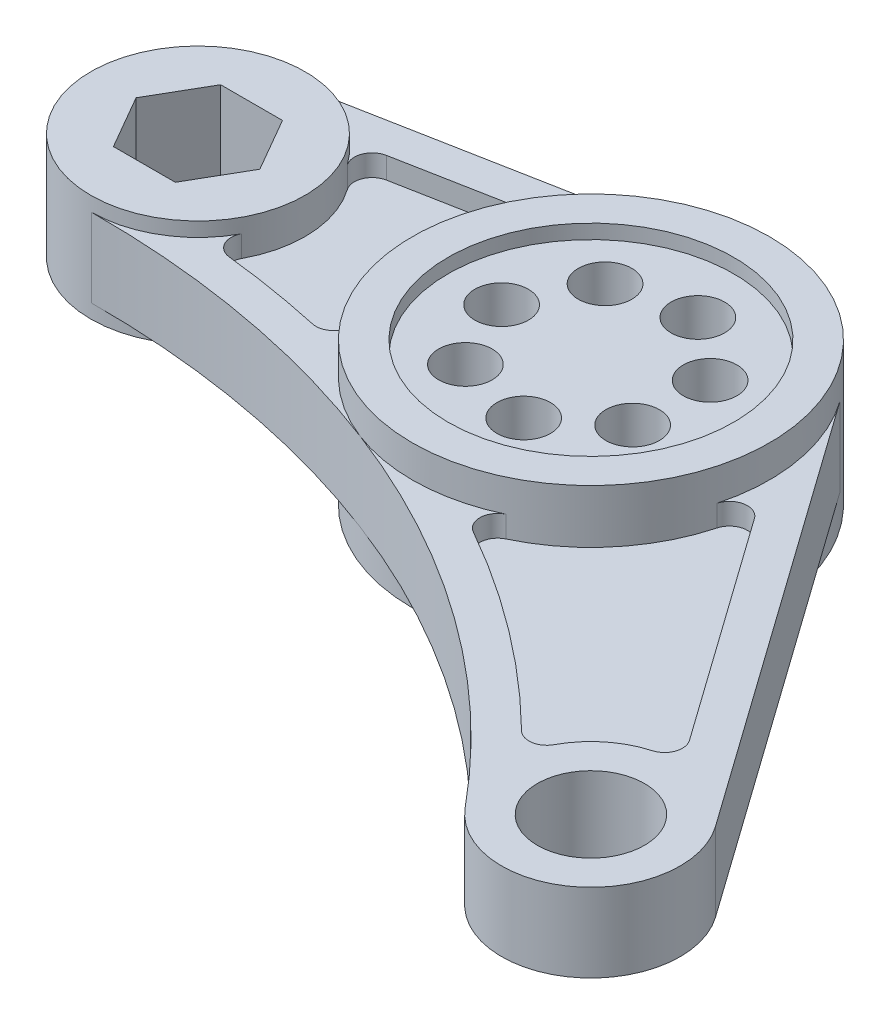
from build123d import *

# Parameters (mm, degrees)
SKETCH_1_R          = 50
SKETCH_1_R_2        = 7.5
EXTRUDE_2_DEPTH     = 20
SKETCH_4_R          = 40
CUT_EXTRUDE_1_DEPTH = 4
SKETCH_6_R          = 30
EXTRUDE_5_DEPTH     = 15
SKETCH_8_R          = 25
SKETCH_8_R_2        = 15
EXTRUDE_6_DEPTH     = 11
EXTRUDE_7_DEPTH     = 11
CUT_EXTRUDE_START   = 11
CUT_EXTRUDE_2_DEPTH = 6
CUT_EXTRUDE_START_2 = -6
CUT_EXTRUDE_3_DEPTH = 6


with BuildPart() as part:
    # 草图1 → 凸台-拉伸2 (new, symmetric)
    with BuildSketch(Plane(origin=(0, 0, 0), x_dir=(1, 0, 0), z_dir=(0, 1, 0))):
        with Locations(Location((0, 0, 0), (0, 0, 270))):
            Circle(SKETCH_1_R)
        with Locations(Location((-25, 0, 0), (0, 0, 270))):
            Circle(SKETCH_1_R_2, mode=Mode.SUBTRACT)
        with Locations(Location((-15.587245046, 19.545787062, 0), (0, 0, 270))):
            Circle(SKETCH_1_R_2, mode=Mode.SUBTRACT)
        with Locations(Location((5.563023349, 24.373197805, 0), (0, 0, 270))):
            Circle(SKETCH_1_R_2, mode=Mode.SUBTRACT)
        with Locations(Location((22.524221698, 10.847093478, 0), (0, 0, 270))):
            Circle(SKETCH_1_R_2, mode=Mode.SUBTRACT)
        with Locations(Location((22.524221698, -10.847093478, 0), (0, 0, 270))):
            Circle(SKETCH_1_R_2, mode=Mode.SUBTRACT)
        with Locations(Location((5.563023349, -24.373197805, 0), (0, 0, 270))):
            Circle(SKETCH_1_R_2, mode=Mode.SUBTRACT)
        with Locations(Location((-15.587245046, -19.545787062, 0), (0, 0, 270))):
            Circle(SKETCH_1_R_2, mode=Mode.SUBTRACT)
    extrude(amount=EXTRUDE_2_DEPTH, both=True)

    # 草图4 → 切除-拉伸1 (cut)
    with BuildSketch(Plane(origin=(0, 20, 0), x_dir=(1, 0, 0), z_dir=(0, 1, 0))):
        with Locations(Location((0, 0, 0), (0, 0, 270))):
            Circle(SKETCH_4_R)
    cut_extrude_1 = extrude(amount=-CUT_EXTRUDE_1_DEPTH, mode=Mode.SUBTRACT)

    # 镜向1: 切除-拉伸1 across plane
    add(cut_extrude_1.mirror(Plane.ZX), mode=Mode.SUBTRACT)



with BuildPart() as body_2:
    # 草图6 → 凸台-拉伸5 (new, symmetric)
    with BuildSketch(Plane(origin=(0, 0, 0), x_dir=(1, 0, 0), z_dir=(0, 1, 0))):
        with Locations(Location((-110, 0, 0), (0, 0, 270))):
            Circle(SKETCH_6_R)
        Polygon((-92.679491924, 0), (-101.339745962, 15), (-118.660254038, 15), (-127.320508076, 0), (-118.660254038, -15), (-101.339745962, -15), align=None, mode=Mode.SUBTRACT)
    extrude(amount=EXTRUDE_5_DEPTH, both=True)


with BuildPart() as body_3:
    # 草图8 → 凸台-拉伸6 (new, symmetric)
    with BuildSketch(Plane(origin=(0, 0, 0), x_dir=(1, 0, 0), z_dir=(0, 1, 0))):
        with Locations(Location((106.066017178, -106.066017178, 0), (0, 0, 270))):
            Circle(SKETCH_8_R)
        with Locations(Location((106.066017178, -106.066017178, 0), (0, 0, 270))):
            Circle(SKETCH_8_R_2, mode=Mode.SUBTRACT)
    extrude(amount=EXTRUDE_6_DEPTH, both=True)


with BuildPart() as part_1:
    add(part.part)

    add(body_2.part)  # 凸台-拉伸7 merges body 2

    add(body_3.part)  # 凸台-拉伸7 merges body 3
    # 草图9 → 凸台-拉伸7 (add, symmetric)
    with BuildSketch(Plane(origin=(0, 0, 0), x_dir=(1, 0, 0), z_dir=(0, 1, 0))):
        with BuildLine():
            Line((-9.330441424, 49.121714779), (-110, 30))
            ThreePointArc((-110, 30), (-88.786796564, 21.213203436), (-80, 0))
            ThreePointArc((-80, 0), (-88.71993646, -21.146131933), (-109.810593048, -29.999402077))
            ThreePointArc((-109.810593048, -29.999402077), (-63.064827616, -34.060904943), (-17.875950367, -46.695293108))
            ThreePointArc((-17.875950367, -46.695293108), (-49.802326137, 4.44165637), (-9.330441424, 49.121714779))
        make_face()
        with BuildLine():
            Line((126.442712652, -91.581878213), (40.753390949, 28.968277929))
            ThreePointArc((40.753390949, 28.968277929), (47.632287093, 15.204118727), (50, 0))
            ThreePointArc((50, 0), (28.33904093, -41.19343102), (-17.875950367, -46.695293108))
            ThreePointArc((-17.875950367, -46.695293108), (39.329861169, -77.545156319), (86.774183491, -121.966493681))
            ThreePointArc((86.774183491, -121.966493681), (90.864028968, -86.219114285), (126.442712652, -91.581878213))
        make_face()
    extrude(amount=EXTRUDE_7_DEPTH, both=True)

    # 草图10 → 切除-拉伸2 (cut)
    with BuildSketch(Plane(origin=(0, 0, 0), x_dir=(1, 0, 0), z_dir=(0, 1, 0)).offset(CUT_EXTRUDE_START)):
        with BuildLine():
            ThreePointArc((-43.829514678, 24.061871148), (-49.930321788, 2.638743289), (-46.121552708, -19.308090941))
            ThreePointArc((-46.121552708, -19.308090941), (-46.894642878, -24.442270002), (-51.807391271, -26.122259963))
            ThreePointArc((-51.807391271, -26.122259963), (-65.699920333, -23.457746699), (-79.715740029, -21.544949554))
            ThreePointArc((-79.715740029, -21.544949554), (-83.598085675, -18.902773341), (-83.577090418, -14.206683259))
            ThreePointArc((-83.577090418, -14.206683259), (-80.054612182, 1.80935028), (-85.479855197, 17.284747578))
            ThreePointArc((-85.479855197, 17.284747578), (-86.028032441, 22.041171589), (-82.326208539, 25.077710319))
            Line((-82.326208539, 25.077710319), (-49.145510288, 31.38022974))
            ThreePointArc((-49.145510288, 31.38022974), (-44.167091223, 29.4065854), (-43.829514678, 24.061871148))
        make_face()
        with BuildLine():
            ThreePointArc((99.202471828, -82.026638126), (90.358856707, -86.616464228), (84.010192893, -94.295689438))
            ThreePointArc((84.010192893, -94.295689438), (80.353400569, -96.884388509), (76.090892576, -95.504345545))
            ThreePointArc((76.090892576, -95.504345545), (49.969670312, -72.96331305), (21.11948881, -54.040220653))
            ThreePointArc((21.11948881, -54.040220653), (18.584494671, -49.509076454), (21.437529998, -45.171144635))
            ThreePointArc((21.437529998, -45.171144635), (38.390543683, -32.033828303), (48.279793254, -13.002367605))
            ThreePointArc((48.279793254, -13.002367605), (52.22522368, -9.381109934), (57.183111675, -11.405776572))
            Line((57.183111675, -11.405776572), (101.905101852, -74.321934522))
            ThreePointArc((101.905101852, -74.321934522), (102.547910869, -78.873778446), (99.202471828, -82.026638126))
        make_face()
    extrude(amount=-CUT_EXTRUDE_2_DEPTH, mode=Mode.SUBTRACT)

    # 草图11 → 切除-拉伸3 (cut)
    with BuildSketch(Plane.XZ.offset(11).offset(CUT_EXTRUDE_START_2)):
        with BuildLine():
            Line((101.905101852, 74.321934522), (57.183111675, 11.405776572))
            ThreePointArc((57.183111675, 11.405776572), (52.22522368, 9.381109934), (48.279793254, 13.002367605))
            ThreePointArc((48.279793254, 13.002367605), (38.390543683, 32.033828303), (21.437529998, 45.171144635))
            ThreePointArc((21.437529998, 45.171144635), (18.584494671, 49.509076454), (21.11948881, 54.040220653))
            ThreePointArc((21.11948881, 54.040220653), (49.969670312, 72.96331305), (76.090892576, 95.504345545))
            ThreePointArc((76.090892576, 95.504345545), (80.353400569, 96.884388509), (84.010192893, 94.295689438))
            ThreePointArc((84.010192893, 94.295689438), (90.358856707, 86.616464228), (99.202471828, 82.026638126))
            ThreePointArc((99.202471828, 82.026638126), (102.547910869, 78.873778446), (101.905101852, 74.321934522))
        make_face()
        with BuildLine():
            Line((-49.145510288, -31.38022974), (-82.326208539, -25.077710319))
            ThreePointArc((-82.326208539, -25.077710319), (-86.028032441, -22.041171589), (-85.479855197, -17.284747578))
            ThreePointArc((-85.479855197, -17.284747578), (-80.054612182, -1.80935028), (-83.577090418, 14.206683259))
            ThreePointArc((-83.577090418, 14.206683259), (-83.598085675, 18.902773341), (-79.715740029, 21.544949554))
            ThreePointArc((-79.715740029, 21.544949554), (-65.699920333, 23.457746699), (-51.807391271, 26.122259963))
            ThreePointArc((-51.807391271, 26.122259963), (-46.894642878, 24.442270002), (-46.121552708, 19.308090941))
            ThreePointArc((-46.121552708, 19.308090941), (-49.930321788, -2.638743289), (-43.829514678, -24.061871148))
            ThreePointArc((-43.829514678, -24.061871148), (-44.167091223, -29.4065854), (-49.145510288, -31.38022974))
        make_face()
    extrude(amount=CUT_EXTRUDE_3_DEPTH, mode=Mode.SUBTRACT)


solid = part_1.part
